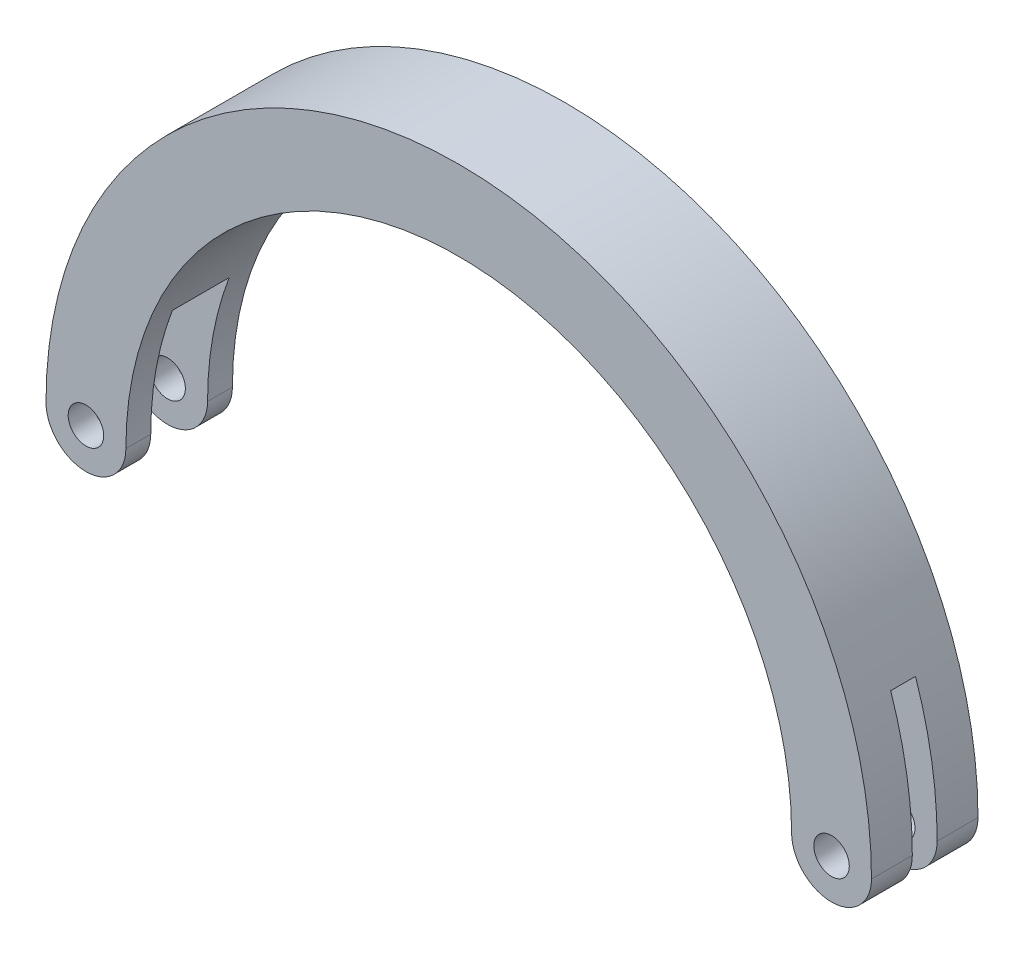
from build123d import *

# Parameters (mm, degrees)
BOSS_EXTRUDE1_DEPTH      = 3
BOSS_EXTRUDE1_DEPTH_BACK = 3
SKETCH1_R                = 1
CUT_EXTRUDE1_DEPTH       = 1.6
CUT_EXTRUDE1_DEPTH_BACK  = 1.6
SKETCH2_R                = 7.5
CUT_EXTRUDE2_DEPTH       = 0.7
CUT_EXTRUDE2_DEPTH_BACK  = 0.7
SKETCH3_R                = 7.5


with BuildPart() as part:
    # Sketch1 → Boss-Extrude1 (new, two sides: drawn at the far end of the back side and taken through both)
    with BuildSketch(Plane.XY.offset(-BOSS_EXTRUDE1_DEPTH_BACK)):
        with BuildLine():
            ThreePointArc((-2.25, 0), (0, -2.25), (2.25, 0))
            ThreePointArc((2.25, 0), (21, 18.75), (39.75, 0))
            ThreePointArc((39.75, 0), (42, -2.25), (44.25, 0))
            ThreePointArc((44.25, 0), (21, 23.25), (-2.25, 0))
        make_face()
        Circle(SKETCH1_R, mode=Mode.SUBTRACT)
        with Locations((42, 0)):
            Circle(SKETCH1_R, mode=Mode.SUBTRACT)
    extrude(amount=BOSS_EXTRUDE1_DEPTH + BOSS_EXTRUDE1_DEPTH_BACK)

    # Sketch2 → Cut-Extrude1 (cut, two sides: drawn at the far end of the back side and taken through both)
    with BuildSketch(Plane.XY.offset(-CUT_EXTRUDE1_DEPTH_BACK)):
        Circle(SKETCH2_R)
    extrude(amount=CUT_EXTRUDE1_DEPTH + CUT_EXTRUDE1_DEPTH_BACK, mode=Mode.SUBTRACT)

    # Sketch3 → Cut-Extrude2 (cut, two sides: drawn at the far end of the back side and taken through both)
    with BuildSketch(Plane.XY.offset(-CUT_EXTRUDE2_DEPTH_BACK)):
        with Locations((42, 0)):
            Circle(SKETCH3_R)
    extrude(amount=CUT_EXTRUDE2_DEPTH + CUT_EXTRUDE2_DEPTH_BACK, mode=Mode.SUBTRACT)


solid = part.part
